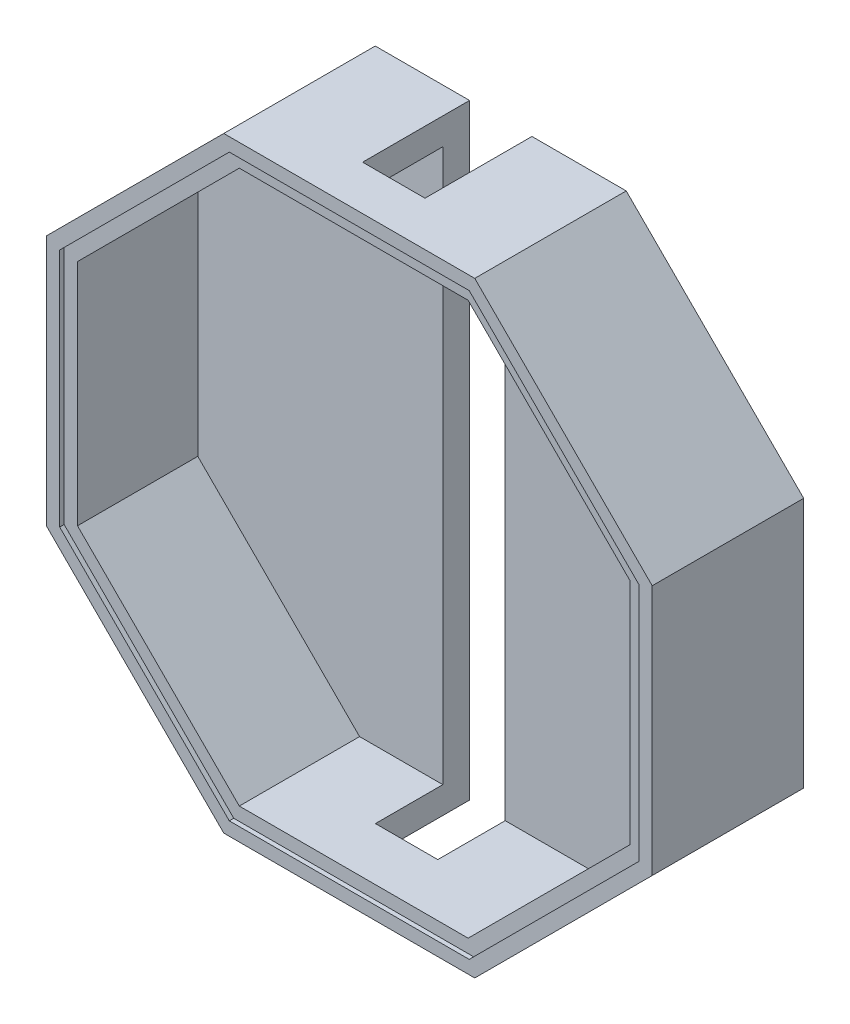
from build123d import *

# Parameters (mm, degrees)
BOSS_EXTRUDE1_DEPTH      = 44.45
BOSS_EXTRUDE1_DEPTH_BACK = 63.5
SKETCH1_W                = 431.8
SKETCH1_H                = 431.8
CUT_EXTRUDE1_DEPTH       = 324.85
CUT_EXTRUDE1_DEPTH_BACK  = 324.85
SKETCH2_OUTSIDE_W        = 557.826
SKETCH2_OUTSIDE_H        = 557.826
CUT_EXTRUDE5_DEPTH       = 22.225
SHELL1_T                 = -19.05
CUT_EXTRUDE3_DEPTH       = 3.175
SKETCH5_W                = 120.0338561
SKETCH5_H                = 81.699458139
CUT_EXTRUDE4_DEPTH       = 393.7


with BuildPart() as part:
    # Sketch1 → Boss-Extrude1 (new, two sides: drawn at the far end of the back side and taken through both)
    with BuildSketch(Plane.XY.offset(-BOSS_EXTRUDE1_DEPTH_BACK)):
        Rectangle(SKETCH1_W, SKETCH1_H)
    extrude(amount=BOSS_EXTRUDE1_DEPTH + BOSS_EXTRUDE1_DEPTH_BACK)

    # Sketch2 outside → Cut-Extrude1 (cut, two sides: drawn at the far end of the back side and taken through both)
    with BuildSketch(Plane.XY.offset(44.45).offset(-CUT_EXTRUDE1_DEPTH_BACK)):
        Rectangle(SKETCH2_OUTSIDE_W, SKETCH2_OUTSIDE_H)
        Polygon((-215.9, 89.428708116), (-215.9, -89.428708116), (-89.428708116, -215.9), (89.428708116, -215.9), (215.9, -89.428708116), (215.9, 89.428708116), (89.428708116, 215.9), (-89.428708116, 215.9), align=None, mode=Mode.SUBTRACT)
    extrude(amount=CUT_EXTRUDE1_DEPTH + CUT_EXTRUDE1_DEPTH_BACK, mode=Mode.SUBTRACT)

    # Sketch6 → Cut-Extrude5 (cut, symmetric)
    with BuildSketch(Plane(origin=(0, 0, 0), x_dir=(0, 0, -1), z_dir=(1, 0, 0))):
        Polygon((-12.7, 215.9), (-3.175, -215.9), (63.5, -215.9), (63.5, 215.9), align=None)
    extrude(amount=CUT_EXTRUDE5_DEPTH, both=True, mode=Mode.SUBTRACT)

    # Shell1
    shell1_openings = [part.faces().sort_by_distance(p)[0] for p in [
        (0, 0, 44.45),
    ]]
    offset(amount=SHELL1_T, openings=shell1_openings, kind=Kind.INTERSECTION)

    # Sketch4 → Cut-Extrude3 (cut)
    with BuildSketch(Plane.XY.offset(44.45)):
        Polygon((85.483323935, 206.375), (-85.483323935, 206.375), (-206.375, 85.483323935), (-206.375, -85.483323935), (-85.483323935, -206.375), (85.483323935, -206.375), (206.375, -85.483323935), (206.375, 85.483323935), align=None)
    extrude(amount=-CUT_EXTRUDE3_DEPTH, mode=Mode.SUBTRACT)

    # Sketch5 → Cut-Extrude4 (cut)
    with BuildSketch(Plane(origin=(0, -196.85, 0), x_dir=(1, 0, 0), z_dir=(0, 1, 0))):
        with Locations((1.389541827, 3.60027093)):
            Rectangle(SKETCH5_W, SKETCH5_H)
    extrude(amount=CUT_EXTRUDE4_DEPTH, mode=Mode.SUBTRACT)


solid = part.part
